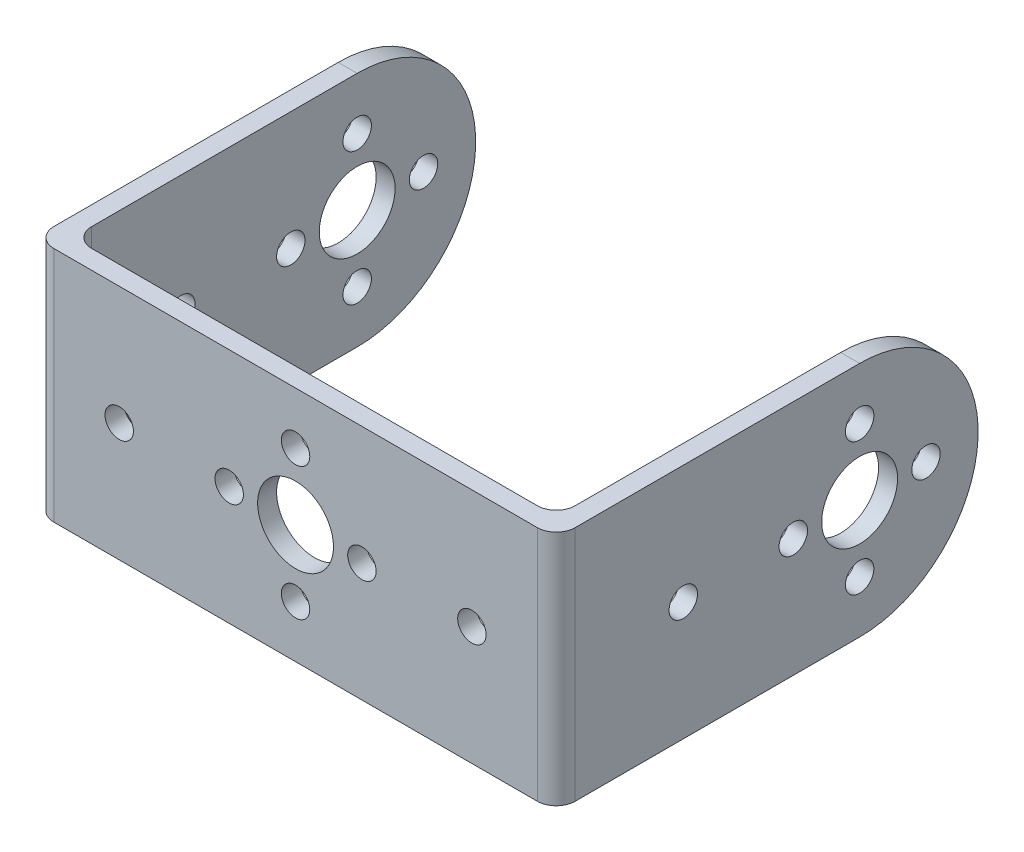
from build123d import *

# Parameters (mm, degrees)
EXTRUDE_1_DEPTH     = 25
SKETCH_2_R          = 1.5
SKETCH_2_R_2        = 4
CUT_EXTRUDE_1_DEPTH = 25
SKETCH_3_R          = 1.5
SKETCH_3_R_2        = 4
CUT_EXTRUDE_2_DEPTH = 25
FILLET_1_R          = 2


with BuildPart() as part:
    # 草图1 → 凸台-拉伸1 (new body)
    with BuildSketch(Plane(origin=(0, 0, 0), x_dir=(1, 0, 0), z_dir=(0, 1, 0))):
        Polygon((0, 0), (27.5, 0), (27.5, 44.5), (25.5, 44.5), (25.5, 2), (0, 2), align=None)
    extrude_1 = extrude(amount=EXTRUDE_1_DEPTH)

    # 草图2 → 切除-拉伸1 (cut)
    with BuildSketch(Plane(origin=(27.5, 0, 0), x_dir=(0, 0, -1), z_dir=(1, 0, 0))):
        with Locations((13.4, 12.5)):
            Circle(SKETCH_2_R)
        with Locations((32, 12.5)):
            Circle(SKETCH_2_R_2)
        with Locations((32, 19.5)):
            Circle(SKETCH_2_R)
        with Locations((39, 12.5)):
            Circle(SKETCH_2_R)
        with Locations((32, 5.5)):
            Circle(SKETCH_2_R)
        with BuildLine():
            ThreePointArc((44.5, 12.5), (40.838834765, 3.661165235), (32, 0))
            Line((32, 0), (44.5, 0))
            Line((44.5, 0), (44.5, 12.5))
        make_face()
        with BuildLine():
            ThreePointArc((32, 25), (40.838834765, 21.338834765), (44.5, 12.5))
            Line((44.5, 12.5), (44.5, 25))
            Line((44.5, 25), (32, 25))
        make_face()
        with Locations((25, 12.5)):
            Circle(SKETCH_2_R)
    cut_extrude_1 = extrude(amount=-CUT_EXTRUDE_1_DEPTH, mode=Mode.SUBTRACT)

    # 镜向1: 凸台-拉伸1, 切除-拉伸1 across plane
    add(extrude_1.mirror(Plane(origin=(0, 25, -2), x_dir=(0, 0, 1), z_dir=(1, 0, 0))))
    add(cut_extrude_1.mirror(Plane(origin=(0, 25, -2), x_dir=(0, 0, 1), z_dir=(1, 0, 0))), mode=Mode.SUBTRACT)

    # 草图3 → 切除-拉伸2 (cut)
    with BuildSketch(Plane.XY):
        with Locations((0, 19.5)):
            Circle(SKETCH_3_R)
        with Locations((7, 12.5)):
            Circle(SKETCH_3_R)
        with Locations((0, 5.5)):
            Circle(SKETCH_3_R)
        with Locations((-7, 12.5)):
            Circle(SKETCH_3_R)
        with Locations((-18.6, 12.5)):
            Circle(SKETCH_3_R)
        with Locations((0, 12.5)):
            Circle(SKETCH_3_R_2)
        with Locations((18.6, 12.5)):
            Circle(SKETCH_3_R)
    extrude(amount=-CUT_EXTRUDE_2_DEPTH, mode=Mode.SUBTRACT)

    # 圆角1
    fillet_1_edges = [part.edges().sort_by_distance(p)[0] for p in [
        (25.5, 12.5, -2),
        (27.5, 12.5, 0),
        (-25.5, 12.5, -2),
        (-27.5, 12.5, 0),
    ]]
    fillet(fillet_1_edges, radius=FILLET_1_R)


solid = part.part
